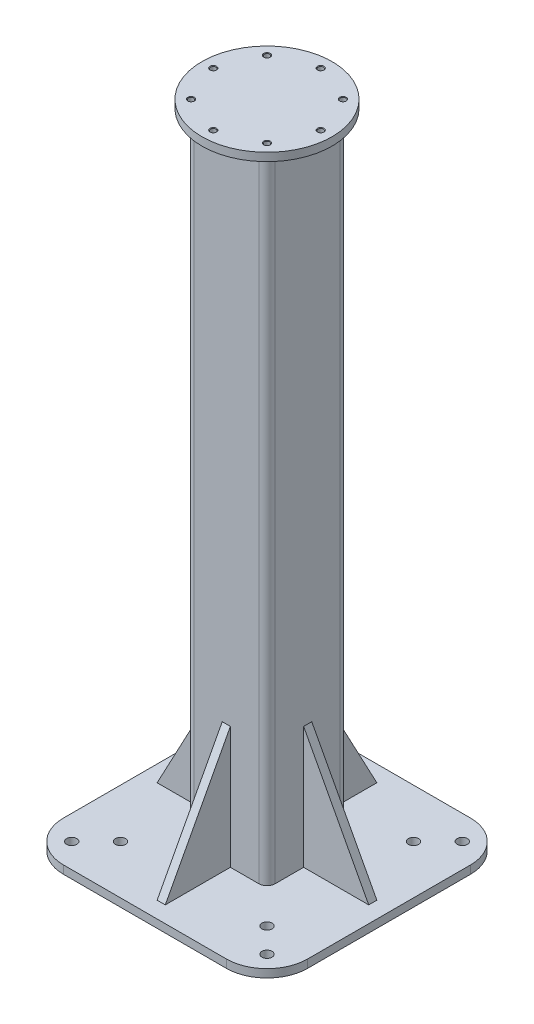
from build123d import *

# Parameters (mm, degrees)
SKETCH_1_W                   = 300
SKETCH_1_H                   = 300
EXTRUDE_1_DEPTH              = 10
SKETCH_2_W                   = 100
SKETCH_2_H                   = 100
SKETCH_2_W_2                 = 90
SKETCH_2_H_2                 = 90
EXTRUDE_2_DEPTH              = 780
SKETCH_3_R                   = 80
EXTRUDE_4_DEPTH              = 10
FILLET_3_R                   = 10
HOLE_WIZARD_M8_1_D           = 6.8
HOLE_WIZARD_M8_1_DEPTH       = 10
HOLE_WIZARD_M8_1_CSINK_D     = 8.05
HOLE_WIZARD_M8_1_CSINK_ANGLE = 90
HOLE_WIZARD_M8_1_TIP         = 2.042926105
SKETCH_7_R                   = 6.25
CUT_EXTRUDE_1_DEPTH          = 818.985329942
MIRROR_2_COPY_1_SKETCH_R     = 6.25
MIRROR_2_COPY_1_DEPTH        = 818.985329942
SKETCH_8_W                   = 10
SKETCH_8_H                   = 150
EXTRUDE_5_DEPTH              = 80
CUT_EXTRUDE_2_DEPTH          = 829.568041865
PATTERN_CIRCULAR_1_COUNT     = 4
FILLET_4_R                   = 50


with BuildPart() as part:
    # 草图1 → 凸台-拉伸1 (new body)
    with BuildSketch(Plane(origin=(0, 0, 0), x_dir=(1, 0, 0), z_dir=(0, 1, 0))):
        Rectangle(SKETCH_1_W, SKETCH_1_H)
    extrude(amount=EXTRUDE_1_DEPTH)

    # 草图2 → 凸台-拉伸2 (add)
    with BuildSketch(Plane(origin=(0, 10, 0), x_dir=(1, 0, 0), z_dir=(0, 1, 0))):
        Rectangle(SKETCH_2_W, SKETCH_2_H)
        Rectangle(SKETCH_2_W_2, SKETCH_2_H_2, mode=Mode.SUBTRACT)
    extrude(amount=EXTRUDE_2_DEPTH)

    # 草图3 → 凸台-拉伸4 (add)
    with BuildSketch(Plane(origin=(0, 790, 0), x_dir=(1, 0, 0), z_dir=(0, 1, 0))):
        with Locations(Location((0, 0, 0), (0, 0, 270))):
            Circle(SKETCH_3_R)
    extrude(amount=EXTRUDE_4_DEPTH)

    # 圆角3
    fillet_3_edges = [part.edges().sort_by_distance(p)[0] for p in [
        (50, 400, 50),
        (50, 400, -50),
        (-50, 400, -50),
        (-50, 400, 50),
        (45, 400, -45),
        (-45, 400, -45),
        (-45, 400, 45),
        (45, 400, 45),
    ]]
    fillet(fillet_3_edges, radius=FILLET_3_R)

    # M8 螺纹孔1
    with Locations(Plane(origin=(-66, 800, 0), x_dir=(0, 0, 1), z_dir=(0, 1, 0))):
        with Locations((0, 0), (-46.669047558, 19.330952442), (-66, 66), (-46.669047558, 112.669047558), (0, 132), (46.669047558, 112.669047558), (66, 66), (46.669047558, 19.330952442)):
            CounterSinkHole(HOLE_WIZARD_M8_1_D / 2, HOLE_WIZARD_M8_1_CSINK_D / 2, depth=HOLE_WIZARD_M8_1_DEPTH, counter_sink_angle=HOLE_WIZARD_M8_1_CSINK_ANGLE)
            with Locations((0, 0, -(HOLE_WIZARD_M8_1_DEPTH + HOLE_WIZARD_M8_1_TIP / 2))):  # 118° drill point
                Cone(0, HOLE_WIZARD_M8_1_D / 2, HOLE_WIZARD_M8_1_TIP, mode=Mode.SUBTRACT)

    # 草图7 → 切除-拉伸1 (cut, through all)
    with BuildSketch(Plane(origin=(0, 10, 0), x_dir=(1, 0, 0), z_dir=(0, 1, 0))):
        with Locations(Location((120, 120, 0), (0, 0, 270))):
            Circle(SKETCH_7_R)
        with Locations(Location((90, 90, 0), (0, 0, 270))):
            Circle(SKETCH_7_R)
    cut_extrude_1 = extrude(amount=-CUT_EXTRUDE_1_DEPTH, mode=Mode.SUBTRACT)

    # 镜向1: 切除-拉伸1 across plane
    add(cut_extrude_1.mirror(Plane.XY), mode=Mode.SUBTRACT)

    # 镜向2: 切除-拉伸1 across plane
    add(cut_extrude_1.mirror(Plane(origin=(0, 0, 0), x_dir=(0, 0, 1), z_dir=(1, 0, 0))), mode=Mode.SUBTRACT)

    # 镜向2 copy 1 sketch → 镜向2 copy 1 (cut, through all)
    with BuildSketch(Plane(origin=(0, 10, 0), x_dir=(-1, 0, 0), z_dir=(0, 1, 0))):
        with Locations(Location((120, 120, 0), (0, 0, 270))):
            Circle(MIRROR_2_COPY_1_SKETCH_R)
        with Locations(Location((90, 90, 0), (0, 0, 270))):
            Circle(MIRROR_2_COPY_1_SKETCH_R)
    extrude(amount=-MIRROR_2_COPY_1_DEPTH, mode=Mode.SUBTRACT)

    # 草图8 → 凸台-拉伸5 (add)
    with BuildSketch(Plane(origin=(0, 0, -50), x_dir=(-1, 0, 0), z_dir=(0, 0, -1))):
        with Locations((0, 85)):
            Rectangle(SKETCH_8_W, SKETCH_8_H)
    extrude_5 = extrude(amount=EXTRUDE_5_DEPTH)

    # 草图9 → 切除-拉伸2 (cut, through all)
    with BuildSketch(Plane(origin=(5, 0, 0), x_dir=(0, 0, -1), z_dir=(1, 0, 0))):
        Polygon((50, 160), (130, 10), (130, 160), align=None)
    cut_extrude_2 = extrude(amount=-CUT_EXTRUDE_2_DEPTH, mode=Mode.SUBTRACT)

    # 阵列(圆周)1: 凸台-拉伸5, 切除-拉伸2 ×4 about axis
    pattern_circular_1_axis = Axis((0, 0, 0), (0, 1, 0))
    add([extrude_5.rotate(pattern_circular_1_axis, i * 360 / PATTERN_CIRCULAR_1_COUNT) for i in range(1, PATTERN_CIRCULAR_1_COUNT)])
    add([cut_extrude_2.rotate(pattern_circular_1_axis, i * 360 / PATTERN_CIRCULAR_1_COUNT) for i in range(1, PATTERN_CIRCULAR_1_COUNT)], mode=Mode.SUBTRACT)

    # 圆角4
    fillet_4_edges = [part.edges().sort_by_distance(p)[0] for p in [
        (150, 5, 150),
        (-150, 5, 150),
        (-150, 5, -150),
        (150, 5, -150),
    ]]
    fillet(fillet_4_edges, radius=FILLET_4_R)


solid = part.part
